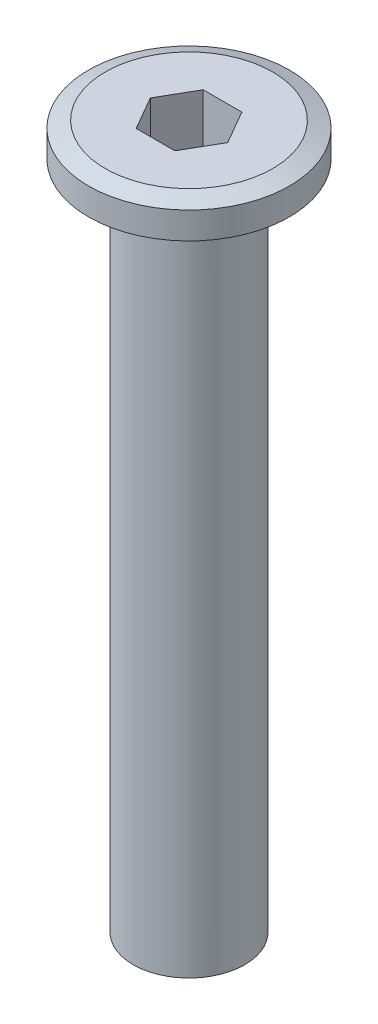
from build123d import *

# Parameters (mm, degrees)
SKETCH3_R           = 2.5
BOSS_EXTRUDE1_DEPTH = 30
CUT_EXTRUDE2_DEPTH  = 3


with BuildPart() as part:
    # Sketch1 → Revolve1 (revolve)
    with BuildSketch(Plane.XY, mode=Mode.PRIVATE) as revolve1_sk:
        Polygon((-2.5, 0), (0, 0), (0, 1.5), (-3.75, 1.5), (-4.5, 1.2), (-4.5, 0), align=None)
    revolve(revolve1_sk.sketch.rotate(Axis((0, 0, 0), (0, 1, 0)), 270), axis=Axis((0, 0, 0), (0, 1, 0)))

    # Sketch3 → Boss-Extrude1 (add)
    with BuildSketch(Plane.XZ):
        with Locations(Location((0, 0, 0), (0, 0, 90))):
            Circle(SKETCH3_R)
    extrude(amount=BOSS_EXTRUDE1_DEPTH)

    # Sketch2 → Cut-Extrude2 (cut)
    with BuildSketch(Plane(origin=(0, 1.5, 0), x_dir=(1, 0, 0), z_dir=(0, 1, 0))):
        Polygon((1.732050808, 0), (0.866025404, 1.5), (-0.866025404, 1.5), (-1.732050808, 0), (-0.866025404, -1.5), (0.866025404, -1.5), align=None)
    extrude(amount=-CUT_EXTRUDE2_DEPTH, mode=Mode.SUBTRACT)


solid = part.part
